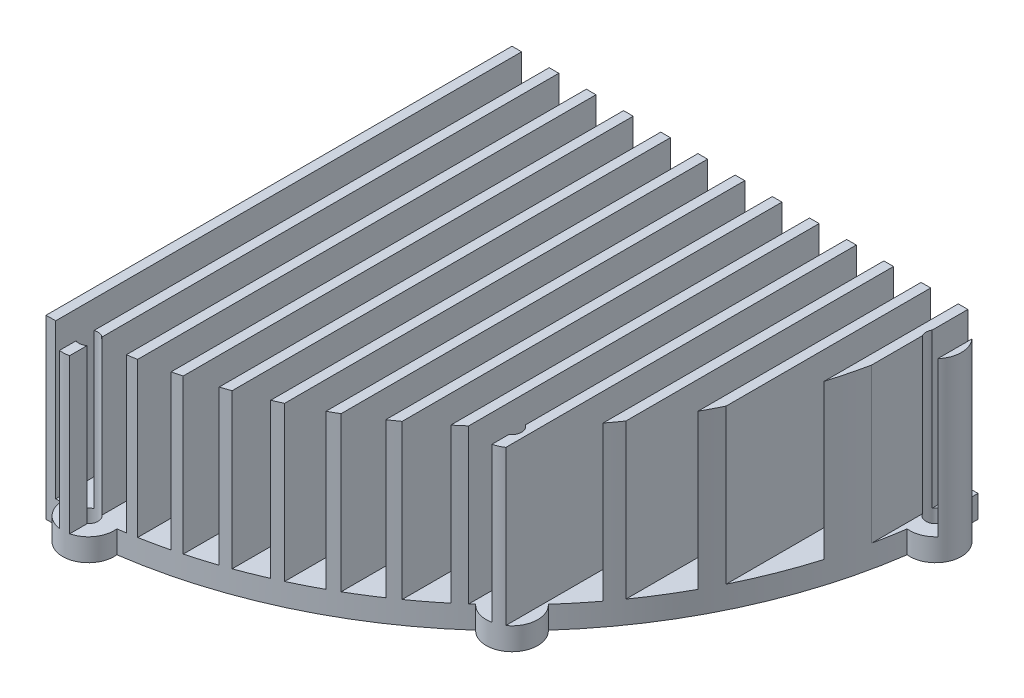
from build123d import *

# Parameters (mm, degrees)
BOSS_EXTRUDE1_DEPTH = 1000
SKETCH2_R           = 3
CUT_EXTRUDE2_DEPTH  = 1016.012315196


with BuildPart() as part:
    # Sketch1 → Boss-Extrude1 (new body)
    with BuildSketch(Plane.XY):
        Polygon((11.571428571, 55), (11.571428571, 7), (3, 7), (3, 55), (0, 55), (0, 7), (0, 0), (165, 0), (165, 7), (165, 10), (165, 55), (162, 55), (162, 7), (153.428571429, 7), (153.428571429, 55), (150.428571429, 55), (150.428571429, 7), (141.857142857, 7), (141.857142857, 55), (138.857142857, 55), (138.857142857, 7), (130.285714286, 7), (130.285714286, 55), (127.285714286, 55), (127.285714286, 7), (118.714285714, 7), (118.714285714, 55), (115.714285714, 55), (115.714285714, 7), (107.142857143, 7), (107.142857143, 55), (104.142857143, 55), (104.142857143, 7), (95.571428571, 7), (95.571428571, 55), (92.571428571, 55), (92.571428571, 7), (84, 7), (84, 55), (81, 55), (81, 7), (72.428571429, 7), (72.428571429, 55), (69.428571429, 55), (69.428571429, 7), (60.857142857, 7), (60.857142857, 55), (57.857142857, 55), (57.857142857, 7), (49.285714286, 7), (49.285714286, 55), (46.285714286, 55), (46.285714286, 7), (37.714285714, 7), (37.714285714, 55), (34.714285714, 55), (34.714285714, 7), (26.142857143, 7), (26.142857143, 55), (23.142857143, 55), (23.142857143, 7), (14.571428571, 7), (14.571428571, 55), align=None)
    extrude(amount=BOSS_EXTRUDE1_DEPTH)

    # Sketch2 → Cut-Extrude2 (cut, through all)
    with BuildSketch(Plane.XZ):
        with BuildLine():
            Line((0, 1000), (0, 145))
            ThreePointArc((0, 145), (2.326211237, 144.981339286), (4.651823732, 144.925361949))
            ThreePointArc((4.651823732, 144.925361949), (13.33482864, 152.417788808), (20.584872923, 143.531400769))
            ThreePointArc((20.584872923, 143.531400769), (61.279647952, 131.41462912), (96.71973071, 108.02913353))
            ThreePointArc((96.71973071, 108.02913353), (108.187337522, 108.187337522), (108.02913353, 96.71973071))
            ThreePointArc((108.02913353, 96.71973071), (131.41462912, 61.279647952), (143.531400769, 20.584872923))
            ThreePointArc((143.531400769, 20.584872923), (152.417788808, 13.33482864), (144.925361949, 4.651823732))
            ThreePointArc((144.925361949, 4.651823732), (144.981339286, 2.326211237), (145, 0))
            Line((145, 0), (165, 0))
            Line((165, 0), (165, 1000))
            Line((165, 1000), (0, 1000))
        make_face()
        with BuildLine():
            ThreePointArc((144.678768073, 9.646453687), (146.649550209, 10.599398525), (147.448231223, 12.637582698))
            ThreePointArc((147.448231223, 12.637582698), (146.46353407, 14.859868557), (144.155861599, 15.623302043))
            ThreePointArc((144.155861599, 15.623302043), (144.448231223, 12.637582698), (144.678768073, 9.646453687))
        make_face()
        with BuildLine():
            ThreePointArc((144.678768073, 9.646453687), (144.448231223, 12.637582698), (144.155861599, 15.623302043))
            ThreePointArc((144.155861599, 15.623302043), (141.459647129, 12.37611547), (144.678768073, 9.646453687))
        make_face()
        with BuildLine():
            ThreePointArc((104.629745412, 100.387331745), (105.296146522, 101.368112079), (105.530483272, 102.530483272))
            ThreePointArc((105.530483272, 102.530483272), (103.664181958, 105.308023063), (100.387331745, 104.629745412))
            ThreePointArc((100.387331745, 104.629745412), (102.530483272, 102.530483272), (104.629745412, 100.387331745))
        make_face()
        with BuildLine():
            ThreePointArc((104.629745412, 100.387331745), (102.530483272, 102.530483272), (100.387331745, 104.629745412))
            ThreePointArc((100.387331745, 104.629745412), (100.409162928, 100.409162928), (104.629745412, 100.387331745))
        make_face()
        with Locations(Location((12.637582698, 144.448231223, 0), (0, 0, 270))):
            Circle(SKETCH2_R)
    extrude(amount=-CUT_EXTRUDE2_DEPTH, mode=Mode.SUBTRACT)


solid = part.part
